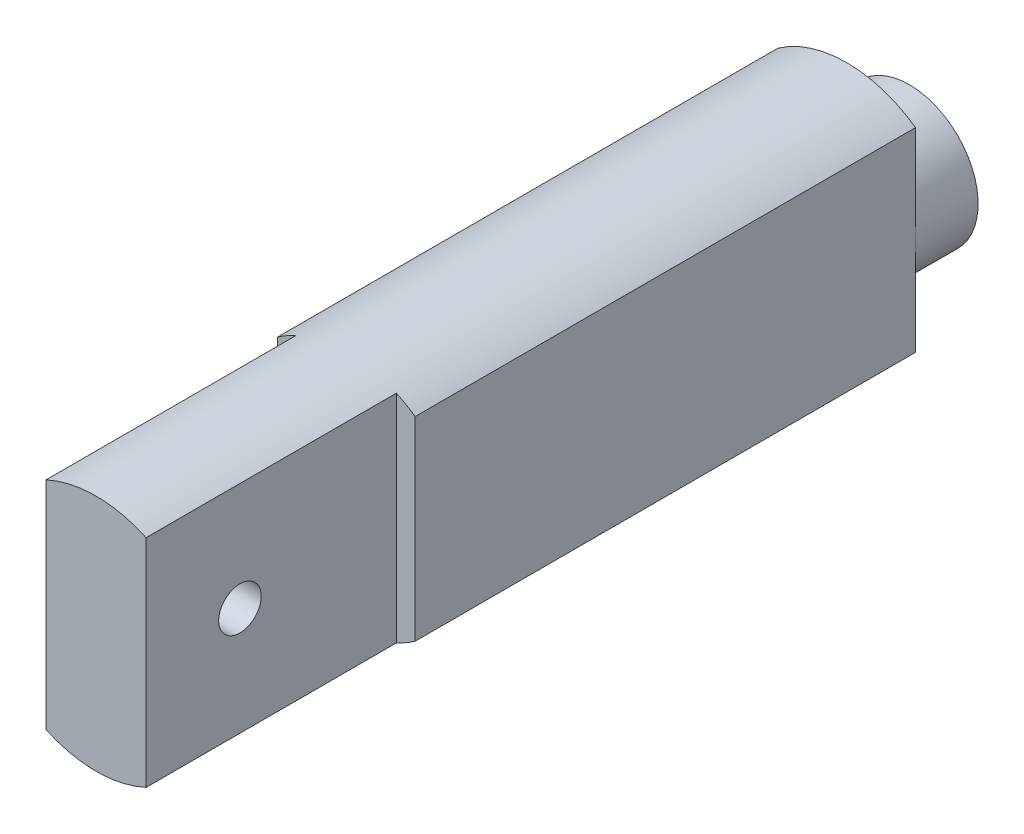
from build123d import *

# Parameters (mm, degrees)
SKETCH1_R              = 19.05
BOSS_EXTRUDE1_DEPTH    = 120
SKETCH4_R              = 11
BOSS_EXTRUDE2_DEPTH    = 10
SKETCH8_OUTSIDE_W      = 68.244
SKETCH8_OUTSIDE_H      = 68.244
SKETCH8_OUTSIDE_W_2    = 22
SKETCH8_OUTSIDE_H_2    = 38.1
CUT_EXTRUDE2_DEPTH     = 123.987011509
SKETCH2_OUTSIDE_W      = 51.448
SKETCH2_OUTSIDE_H      = 67.548
SKETCH2_OUTSIDE_W_2    = 16
SKETCH2_OUTSIDE_H_2    = 38.1
CUT_EXTRUDE1_DEPTH     = 40
M8X1_25_TAPPED_HOLE1_D = 6.8


with BuildPart() as part:
    # Sketch1 → Boss-Extrude1 (new body)
    with BuildSketch(Plane.XY):
        Circle(SKETCH1_R)
    extrude(amount=BOSS_EXTRUDE1_DEPTH)

    # Sketch4 → Boss-Extrude2 (add)
    with BuildSketch(Plane(origin=(0, 0, 0), x_dir=(-1, 0, 0), z_dir=(0, 0, -1))):
        Circle(SKETCH4_R)
    extrude(amount=BOSS_EXTRUDE2_DEPTH)

    # Sketch8 outside → Cut-Extrude2 (cut, through all)
    with BuildSketch(Plane(origin=(0, 0, 0), x_dir=(-1, 0, 0), z_dir=(0, 0, -1))):
        Rectangle(SKETCH8_OUTSIDE_W, SKETCH8_OUTSIDE_H)
        Rectangle(SKETCH8_OUTSIDE_W_2, SKETCH8_OUTSIDE_H_2, mode=Mode.SUBTRACT)
    extrude(amount=-CUT_EXTRUDE2_DEPTH, mode=Mode.SUBTRACT)

    # Sketch2 outside → Cut-Extrude1 (cut)
    with BuildSketch(Plane.XY.offset(120)):
        Rectangle(SKETCH2_OUTSIDE_W, SKETCH2_OUTSIDE_H)
        Rectangle(SKETCH2_OUTSIDE_W_2, SKETCH2_OUTSIDE_H_2, mode=Mode.SUBTRACT)
    extrude(amount=-CUT_EXTRUDE1_DEPTH, mode=Mode.SUBTRACT)

    # M8x1.25 Tapped Hole1 (through all)
    with Locations(Plane(origin=(8, 0, 0), x_dir=(0, 0, -1), z_dir=(1, 0, 0))):
        with Locations((-105, 0)):
            Hole(M8X1_25_TAPPED_HOLE1_D / 2)


solid = part.part
